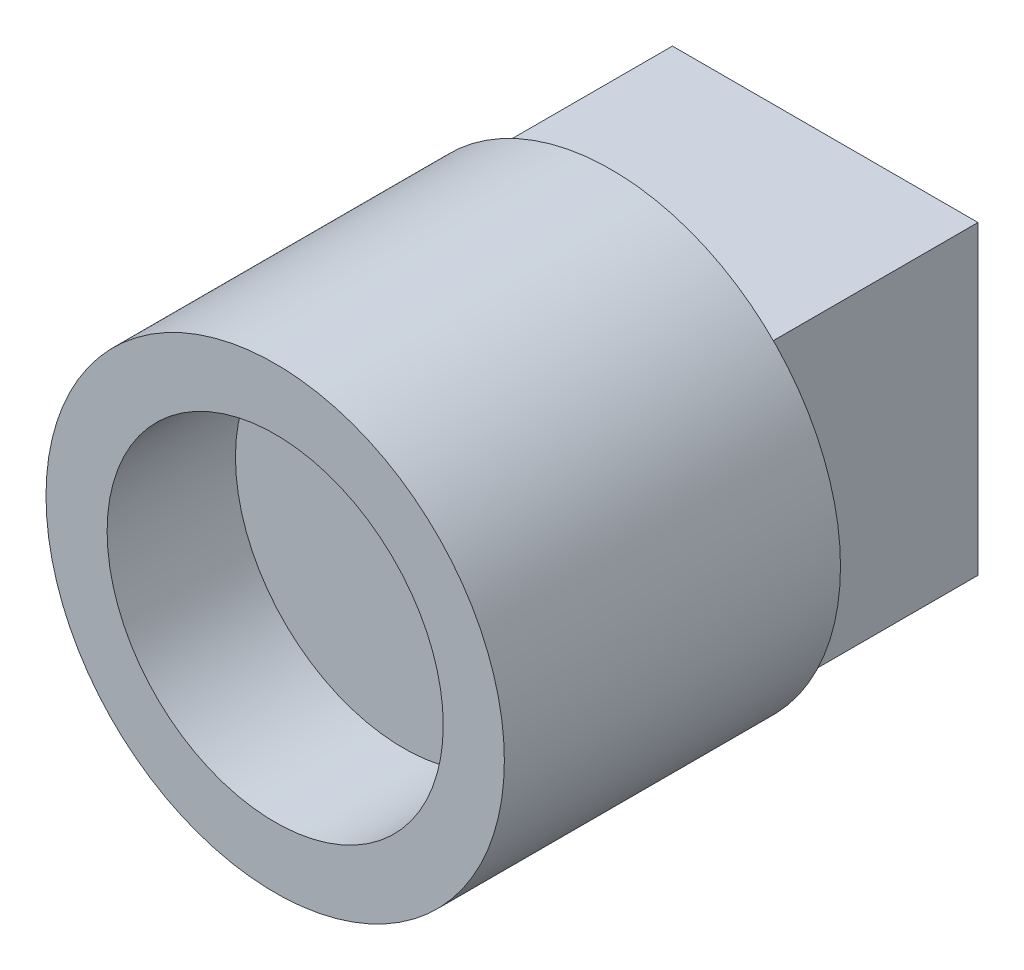
from build123d import *

# Parameters (mm, degrees)
SKETCH1_R           = 75
BOSS_EXTRUDE1_DEPTH = 110
SKETCH3_W           = 100
SKETCH3_H           = 100
BOSS_EXTRUDE2_DEPTH = 70
SKETCH4_R           = 55
CUT_EXTRUDE1_DEPTH  = 42


with BuildPart() as part:
    # Sketch1 → Boss-Extrude1 (new body)
    with BuildSketch(Plane.XY):
        Circle(SKETCH1_R)
    extrude(amount=BOSS_EXTRUDE1_DEPTH)

    # Sketch3 → Boss-Extrude2 (add)
    with BuildSketch(Plane(origin=(0, 0, 0), x_dir=(-1, 0, 0), z_dir=(0, 0, -1))):
        Rectangle(SKETCH3_W, SKETCH3_H)
    extrude(amount=BOSS_EXTRUDE2_DEPTH)

    # Sketch4 → Cut-Extrude1 (cut)
    with BuildSketch(Plane.XY.offset(110)):
        Circle(SKETCH4_R)
    extrude(amount=-CUT_EXTRUDE1_DEPTH, mode=Mode.SUBTRACT)


solid = part.part
